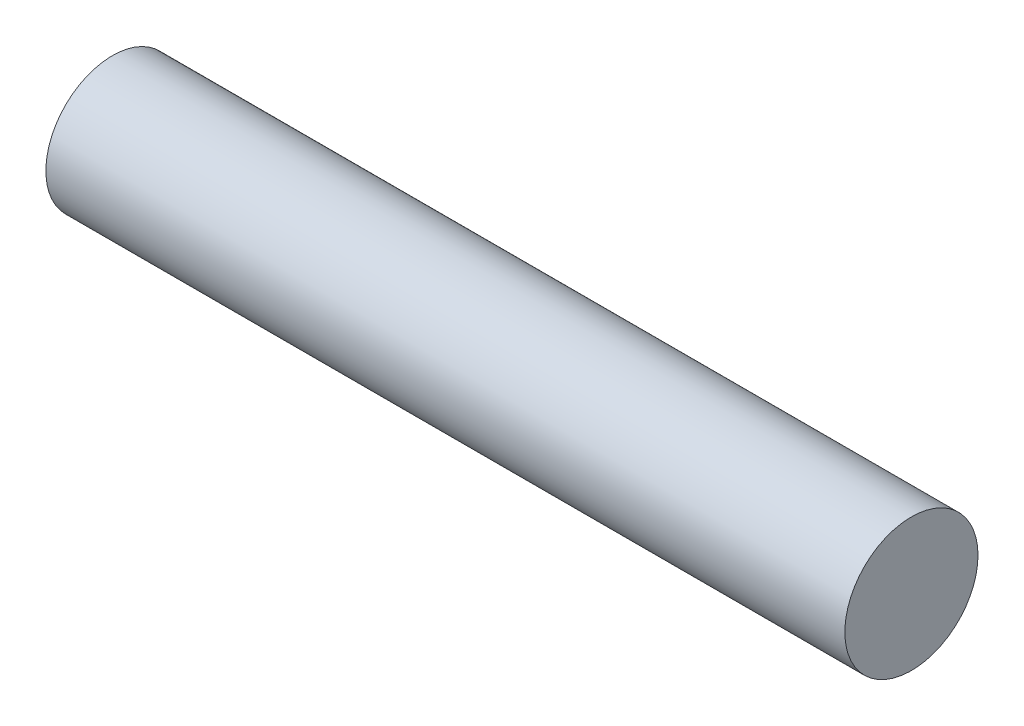
from build123d import *

# Parameters (mm, degrees)
SKETCH3_R           = 2
BOSS_EXTRUDE1_DEPTH = 24


with BuildPart() as part:
    # Sketch3 → Boss-Extrude1 (new body)
    with BuildSketch(Plane(origin=(0, 0, 0), x_dir=(0, 0, -1), z_dir=(1, 0, 0))):
        Circle(SKETCH3_R)
    extrude(amount=BOSS_EXTRUDE1_DEPTH)


solid = part.part
